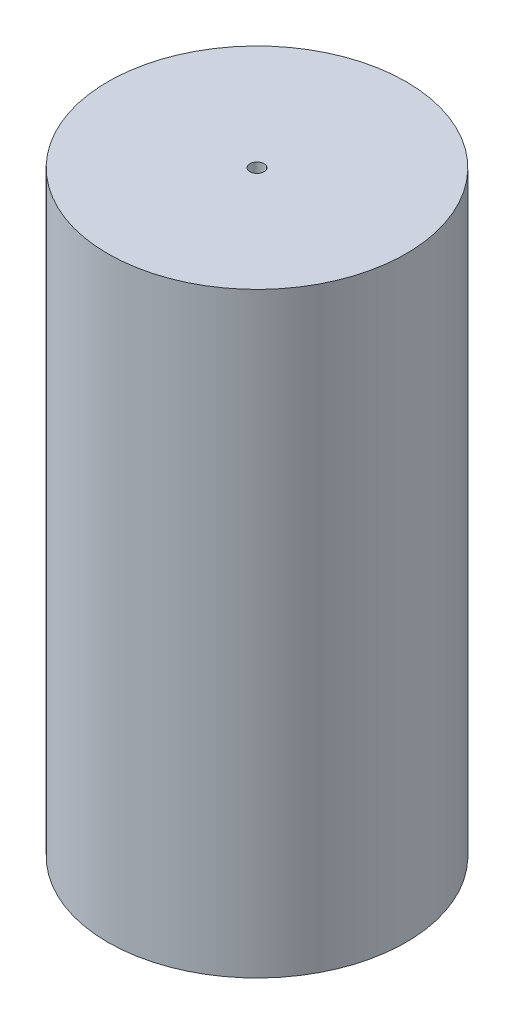
from build123d import *

# Parameters (mm, degrees)
SKIZZE1_R                       = 35
AUFSATZ_LINEAR_AUSTRAGEN2_DEPTH = 140
AU_ENGEWINDE_R                  = 3
AUFSATZ_LINEAR_AUSTRAGEN4_DEPTH = 10
KERNLOCH_F_R_M4X0_71_D          = 3.3
KERNLOCH_F_R_M4X0_71_DEPTH      = 15
KERNLOCH_F_R_M4X0_71_TIP        = 0.991420021


with BuildPart() as part:
    # Skizze1 → Aufsatz-Linear austragen2 (new body)
    with BuildSketch(Plane(origin=(0, 0, 0), x_dir=(1, 0, 0), z_dir=(0, 1, 0))):
        with Locations(Location((0, 0, 0), (0, 0, 270))):
            Circle(SKIZZE1_R)
    extrude(amount=AUFSATZ_LINEAR_AUSTRAGEN2_DEPTH)

    # Außengewinde → Aufsatz-Linear austragen4 (add)
    with BuildSketch(Plane.XZ):
        with Locations(Location((0, 0, 0), (0, 0, 90))):
            Circle(AU_ENGEWINDE_R)
    extrude(amount=AUFSATZ_LINEAR_AUSTRAGEN4_DEPTH)

    # Kernloch für M4x0.71
    with Locations(Plane(origin=(0, 140, 0), x_dir=(1, 0, 0), z_dir=(0, 1, 0))):
        with Locations((0, 0)):
            Hole(KERNLOCH_F_R_M4X0_71_D / 2, depth=KERNLOCH_F_R_M4X0_71_DEPTH)
            with Locations((0, 0, -(KERNLOCH_F_R_M4X0_71_DEPTH + KERNLOCH_F_R_M4X0_71_TIP / 2))):  # 118° drill point
                Cone(0, KERNLOCH_F_R_M4X0_71_D / 2, KERNLOCH_F_R_M4X0_71_TIP, mode=Mode.SUBTRACT)


solid = part.part
